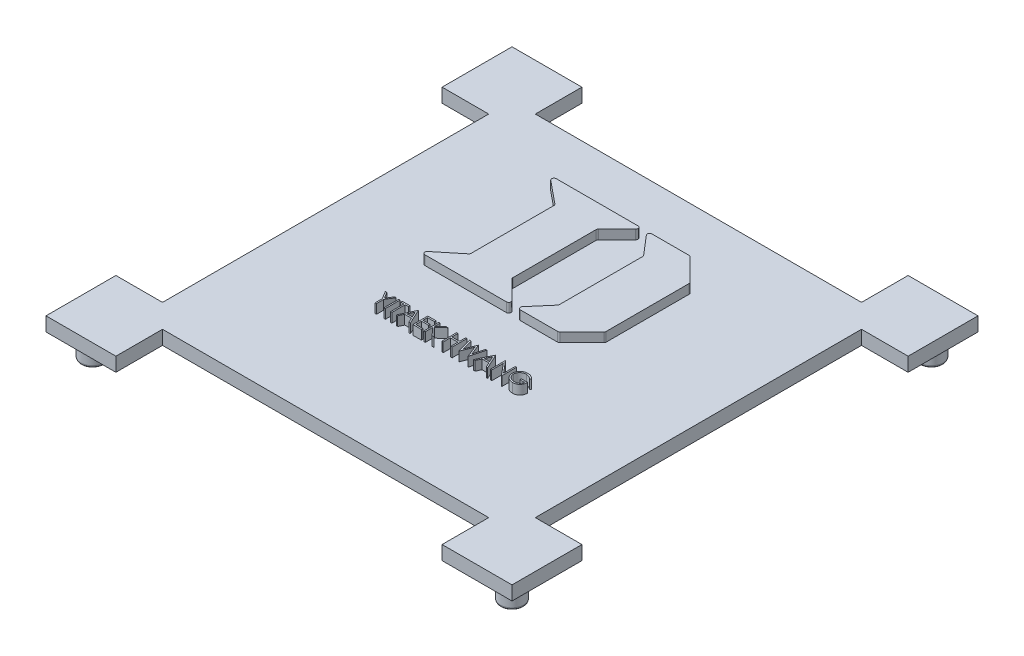
from build123d import *

# Parameters (mm, degrees)
BOSS_EXTRUDE1_DEPTH = 3
SKETCH2_W           = 0.284935898
SKETCH2_H           = 3.175
BOSS_EXTRUDE2_DEPTH = 2
BOSS_EXTRUDE6_DEPTH = 2
FILLET1_R           = 0.5
FILLET2_R           = 0.5
SKETCH5_R           = 2.5
BOSS_EXTRUDE7_DEPTH = 5
FILLET3_R           = 0.5


with BuildPart() as part:
    # Sketch1 → Boss-Extrude1 (new body)
    with BuildSketch(Plane(origin=(0, 0, 0), x_dir=(1, 0, 0), z_dir=(0, 1, 0))):
        Polygon((15, 10), (85, 10), (85, 0), (100, 0), (100, 15), (90, 15), (90, 85), (100, 85), (100, 100), (85, 100), (85, 90), (15, 90), (15, 100), (0, 100), (0, 85), (10, 85), (10, 15), (0, 15), (0, 0), (15, 0), align=None)
    extrude(amount=BOSS_EXTRUDE1_DEPTH)

    # Sketch2 → Boss-Extrude2 (add)
    # profile 1 of 11: a face of its own
    with BuildSketch(Plane(origin=(0, 3, 0), x_dir=(1, 0, 0), z_dir=(0, 1, 0))):
        Polygon((33.880769231, 38.928025518), (34.207046274, 38.928025518), (35.041501402, 37.563767705), (35.874684495, 38.928025518), (36.200961538, 38.928025518), (35.183333333, 37.26229535), (35.183333333, 35.753025518), (34.898397436, 35.753025518), (34.898397436, 37.26229535), align=None)
    # profile 2 of 11: a face of its own
    with BuildSketch(Plane(origin=(0, 3, 0), x_dir=(1, 0, 0), z_dir=(0, 1, 0))):
        with Locations((36.913301282, 37.340525518)):
            Rectangle(SKETCH2_W, SKETCH2_H)
    # profile 3 of 11: a face of its own
    with BuildSketch(Plane(origin=(0, 3, 0), x_dir=(1, 0, 0), z_dir=(0, 1, 0))):
        Polygon((37.503525641, 38.602384492), (37.503525641, 38.928025518), (39.172435897, 38.928025518), (39.172435897, 38.602384492), (38.480448718, 38.602384492), (38.480448718, 35.753025518), (38.195512821, 35.753025518), (38.195512821, 38.602384492), align=None)
    # profile 4 of 11: a face of its own
    with BuildSketch(Plane(origin=(0, 3, 0), x_dir=(1, 0, 0), z_dir=(0, 1, 0))):
        Polygon((40.963461538, 38.928025518), (42.428846154, 35.753025518), (42.119105569, 35.753025518), (41.649724559, 36.770653723), (40.210416667, 36.770653723), (39.727679287, 35.753025518), (39.416666667, 35.753025518), (40.92275641, 38.928025518), align=None)
        Polygon((40.939928886, 38.309180366), (40.36496895, 37.096294749), (41.499624399, 37.096294749), align=None, mode=Mode.SUBTRACT)
    # profile 5 of 11: a face of its own
    with BuildSketch(Plane(origin=(0, 3, 0), x_dir=(1, 0, 0), z_dir=(0, 1, 0))):
        Polygon((42.998717949, 38.928025518), (44.78974359, 38.928025518), (44.78974359, 38.602384492), (43.283653846, 38.602384492), (43.283653846, 37.625461415), (44.78974359, 37.625461415), (44.78974359, 37.29982039), (43.283653846, 37.29982039), (43.283653846, 36.078666544), (44.78974359, 36.078666544), (44.78974359, 35.753025518), (42.998717949, 35.753025518), align=None)
    # profile 6 of 11: a face of its own
    with BuildSketch(Plane(origin=(0, 3, 0), x_dir=(1, 0, 0), z_dir=(0, 1, 0))):
        Polygon((45.359615385, 38.928025518), (45.644551282, 38.928025518), (45.644551282, 37.718956007), (46.968103966, 38.928025518), (47.374519231, 38.928025518), (45.814367989, 37.503346031), (47.496634615, 35.753025518), (47.116932091, 35.753025518), (45.644551282, 37.285191984), (45.644551282, 35.753025518), (45.359615385, 35.753025518), align=None)
    # profile 7 of 11: a face of its own
    with BuildSketch(Plane(origin=(0, 3, 0), x_dir=(1, 0, 0), z_dir=(0, 1, 0))):
        Polygon((49.185897436, 38.928025518), (49.470833333, 38.928025518), (49.470833333, 37.625461415), (51.099038462, 37.625461415), (51.099038462, 38.928025518), (51.383974359, 38.928025518), (51.383974359, 35.753025518), (51.099038462, 35.753025518), (51.099038462, 37.29982039), (49.470833333, 37.29982039), (49.470833333, 35.753025518), (49.185897436, 35.753025518), align=None)
    # profile 8 of 11: a face of its own
    with BuildSketch(Plane(origin=(0, 3, 0), x_dir=(1, 0, 0), z_dir=(0, 1, 0))):
        Polygon((51.994551282, 38.928025518), (52.289027444, 38.928025518), (52.910416667, 36.599564981), (53.83455028, 38.928025518), (53.875891426, 38.928025518), (54.782852564, 36.615465422), (55.407421875, 38.928025518), (55.698717949, 38.928025518), (54.842638221, 35.753025518), (54.801933093, 35.753025518), (53.846634615, 38.181340822), (52.879887821, 35.753025518), (52.839182692, 35.753025518), align=None)
    # profile 9 of 11: a face of its own
    with BuildSketch(Plane(origin=(0, 3, 0), x_dir=(1, 0, 0), z_dir=(0, 1, 0))):
        Polygon((57.571153846, 38.928025518), (59.036538462, 35.753025518), (58.726797877, 35.753025518), (58.257416867, 36.770653723), (56.818108974, 36.770653723), (56.335371595, 35.753025518), (56.024358974, 35.753025518), (57.530448718, 38.928025518), align=None)
        Polygon((57.547621194, 38.309180366), (56.972661258, 37.096294749), (58.107316707, 37.096294749), align=None, mode=Mode.SUBTRACT)
    # profile 10 of 11: a face of its own
    with BuildSketch(Plane(origin=(0, 3, 0), x_dir=(1, 0, 0), z_dir=(0, 1, 0))):
        Polygon((59.606410256, 35.753025518), (59.606410256, 38.928025518), (59.666195913, 38.928025518), (61.763782051, 36.429112257), (61.763782051, 38.928025518), (62.048717949, 38.928025518), (62.048717949, 35.753025518), (61.983844151, 35.753025518), (59.891346154, 38.246214621), (59.891346154, 35.753025518), align=None)
    # profile 11 of 11: a face of its own
    with BuildSketch(Plane(origin=(0, 3, 0), x_dir=(1, 0, 0), z_dir=(0, 1, 0))):
        with BuildLine():
            Line((65.834294872, 38.386138499), (65.590064103, 38.154628082))
            add(Edge.make_bspline(
                [(65.590064103, 38.154628082), (65.545869111, 38.196203222), (65.458532983, 38.278362119), (65.31614762, 38.384961379), (65.167590609, 38.476279913), (65.01363713, 38.55058057), (64.858099728, 38.60986486), (64.703042909, 38.65207253), (64.550057166, 38.67898976), (64.448305475, 38.682208638), (64.398167067, 38.683794749)],
                knots=[0, 0, 0, 0, 1.08915593, 2.152340314, 3.188132944, 4.216796309, 5.218260357, 6.173443236, 7.099959455, 8, 8, 8, 8], degree=3))
            add(Edge.make_bspline(
                [(64.398167067, 38.683794749), (64.36740159, 38.683419549), (64.305950426, 38.682670123), (64.214671948, 38.673105013), (64.124350784, 38.659348315), (64.035157437, 38.639443898), (63.946918484, 38.614217108), (63.859940818, 38.582661723), (63.774062189, 38.545872323), (63.69009153, 38.503361365), (63.608684073, 38.45666179), (63.531797515, 38.404910614), (63.458941789, 38.349766497), (63.39148626, 38.289848823), (63.329042912, 38.225700338), (63.27012546, 38.158514339), (63.216806056, 38.086455248), (63.168644785, 38.010848859), (63.125681031, 37.933023087), (63.08775461, 37.853727018), (63.055916537, 37.773223664), (63.030725674, 37.691412008), (63.009942438, 37.608924973), (62.995321466, 37.525191405), (62.987078511, 37.440121647), (62.985652682, 37.383155563), (62.984935897, 37.354517906)],
                knots=[0, 0, 0, 0, 1.02818874, 2.053710826, 3.065248034, 4.081641283, 5.106893873, 6.131558223, 7.173050175, 8.228653731, 9.27666206, 10.308777013, 11.325269123, 12.329503258, 13.32196095, 14.316845687, 15.314881793, 16.315733098, 17.311955233, 18.285320748, 19.252783886, 20.203351036, 21.145449891, 22.095197417, 23.042428769, 24, 24, 24, 24], degree=3))
            add(Edge.make_bspline(
                [(62.984935897, 37.354517906), (62.985621442, 37.325243664), (62.986990659, 37.26677512), (62.995753949, 37.179513354), (63.012017424, 37.093547596), (63.03375956, 37.008595361), (63.060956443, 36.924511158), (63.09485879, 36.841659524), (63.135014013, 36.760043526), (63.181492885, 36.680398545), (63.232461798, 36.602816945), (63.289560165, 36.529737951), (63.350212265, 36.460188417), (63.416627732, 36.395712545), (63.486676888, 36.334585725), (63.562452595, 36.278492073), (63.642464827, 36.226351113), (63.726835655, 36.178819985), (63.814649608, 36.136357956), (63.904689662, 36.098599136), (63.997243467, 36.06750288), (64.091824621, 36.042159029), (64.188320374, 36.021385188), (64.287220538, 36.008020724), (64.387797924, 35.998322613), (64.45559654, 35.997613526), (64.489753606, 35.997256287)],
                knots=[0, 0, 0, 0, 0.93586088, 1.869166235, 2.799637598, 3.729985548, 4.670839027, 5.622275134, 6.589130586, 7.576015415, 8.568469353, 9.55398029, 10.53834874, 11.515998671, 12.510579167, 13.508179873, 14.527009472, 15.561807829, 16.601455013, 17.643573243, 18.680854198, 19.719860599, 20.772568776, 21.833555941, 22.908541556, 24, 24, 24, 24], degree=3))
            add(Edge.make_bspline(
                [(64.489753606, 35.997256287), (64.530918249, 35.998116781), (64.611751715, 35.999806502), (64.730575131, 36.012960336), (64.844696488, 36.033504213), (64.953795115, 36.063590419), (65.057997727, 36.101965896), (65.157686323, 36.148225996), (65.252076042, 36.204145057), (65.341450635, 36.267258493), (65.423780368, 36.33757552), (65.498033752, 36.41345299), (65.563026446, 36.494522593), (65.619727137, 36.580306844), (65.666634274, 36.671515799), (65.705135952, 36.767702481), (65.734648295, 36.868910152), (65.746763165, 36.938843275), (65.752884615, 36.974179364)],
                knots=[0, 0, 0, 0, 1.13008108, 2.219097802, 3.278683437, 4.311054135, 5.322181354, 6.324827112, 7.324222904, 8.330512327, 9.32562643, 10.293043162, 11.24128371, 12.174520618, 13.111833804, 14.052305215, 15.015860969, 16, 16, 16, 16], degree=3))
            Line((65.752884615, 36.974179364), (64.694551282, 36.974179364))
            Line((64.694551282, 36.974179364), (64.694551282, 37.29982039))
            Line((64.694551282, 37.29982039), (66.037820513, 37.29982039))
            add(Edge.make_bspline(
                [(66.037820513, 37.29982039), (66.036273065, 37.239125739), (66.033244429, 37.120335344), (66.012000127, 36.947098027), (65.977695148, 36.783475134), (65.930831865, 36.629294347), (65.870166432, 36.48477416), (65.796349924, 36.349767838), (65.708200929, 36.225147563), (65.608859314, 36.109895967), (65.497371495, 36.007090182), (65.376749961, 35.916733367), (65.246795426, 35.840621709), (65.107630815, 35.778699536), (64.959711707, 35.730372412), (64.80269582, 35.696108196), (64.636796082, 35.675579587), (64.523097811, 35.672956693), (64.464948918, 35.671615262)],
                knots=[0, 0, 0, 0, 1.140356446, 2.231883559, 3.274166699, 4.278491846, 5.25512956, 6.21435461, 7.1637429, 8.11826594, 9.068280886, 10.0076534, 10.945064095, 11.891975133, 12.864533718, 13.863980011, 14.907571808, 16, 16, 16, 16], degree=3))
            add(Edge.make_bspline(
                [(64.464948918, 35.671615262), (64.429107581, 35.672131536), (64.358416913, 35.673149795), (64.254013, 35.680386389), (64.15248773, 35.691526626), (64.053855893, 35.708349702), (63.957754683, 35.728955138), (63.864664059, 35.755340948), (63.774229407, 35.785883268), (63.686310949, 35.820622914), (63.601706682, 35.860874346), (63.52003977, 35.905605233), (63.440858784, 35.954584925), (63.364703085, 36.008660477), (63.291175871, 36.067427423), (63.220751247, 36.13100355), (63.153034958, 36.199194494), (63.110616537, 36.247616882), (63.089242788, 36.272015903)],
                knots=[0, 0, 0, 0, 1.107784379, 2.184907829, 3.233506516, 4.263428166, 5.276301166, 6.270063455, 7.25232949, 8.225834625, 9.190232166, 10.146266622, 11.1027726, 12.066435141, 13.031522626, 14.010570082, 14.99756817, 16, 16, 16, 16], degree=3))
            add(Edge.make_bspline(
                [(63.089242788, 36.272015903), (63.058231264, 36.310724281), (62.996722976, 36.387498518), (62.91754922, 36.510507039), (62.850056518, 36.637871583), (62.79529428, 36.76994671), (62.752533301, 36.906608882), (62.721866201, 37.047683468), (62.70389816, 37.193352133), (62.701309594, 37.291927051), (62.7, 37.341797553)],
                knots=[0, 0, 0, 0, 1.023165419, 2.029347347, 3.013907458, 3.994755782, 4.975994455, 5.96558838, 6.970761222, 8, 8, 8, 8], degree=3))
            add(Edge.make_bspline(
                [(62.7, 37.341797553), (62.700482816, 37.379141225), (62.701442312, 37.453353954), (62.713076887, 37.563533083), (62.729769602, 37.671755854), (62.754305144, 37.777933801), (62.785235327, 37.882137838), (62.823837418, 37.984416348), (62.868781717, 38.084829689), (62.921019988, 38.182686698), (62.979153748, 38.276688844), (63.042245734, 38.366457708), (63.111191857, 38.450358503), (63.184866189, 38.529453784), (63.264147744, 38.602749881), (63.348293793, 38.670925395), (63.437369183, 38.734071778), (63.531654146, 38.791194414), (63.629741403, 38.842505698), (63.731395832, 38.887490197), (63.836586404, 38.924667919), (63.944525045, 38.956212705), (64.056028778, 38.979540011), (64.170288443, 38.996457087), (64.287899616, 39.008032774), (64.367398014, 39.008963735), (64.407707332, 39.009435774)],
                knots=[0, 0, 0, 0, 1.008945113, 2.00506715, 2.99143336, 3.967273523, 4.948097931, 5.927297278, 6.919902385, 7.919676788, 8.923139349, 9.905703106, 10.883022732, 11.856032218, 12.825136022, 13.798837087, 14.781400844, 15.773989409, 16.776158564, 17.77167057, 18.775803737, 19.789618931, 20.80898985, 21.851988756, 22.910860228, 24, 24, 24, 24], degree=3))
            add(Edge.make_bspline(
                [(64.407707332, 39.009435774), (64.440580596, 39.008910093), (64.505764415, 39.007867727), (64.602761329, 39.000642654), (64.698258993, 38.98919099), (64.792399003, 38.973563834), (64.884860778, 38.952278914), (64.975907718, 38.926807899), (65.065671805, 38.897151746), (65.153871717, 38.861783292), (65.241100502, 38.821638933), (65.327843171, 38.776451042), (65.413803344, 38.725446931), (65.499130092, 38.668475152), (65.584361477, 38.606514195), (65.668149403, 38.537791933), (65.752516359, 38.465018433), (65.806765148, 38.412692452), (65.834294872, 38.386138499)],
                knots=[0, 0, 0, 0, 0.985871117, 1.954866573, 2.915460327, 3.869826059, 4.81536089, 5.759505086, 6.70452669, 7.649098992, 8.607881297, 9.583363685, 10.581137262, 11.603961102, 12.659522466, 13.73993555, 14.853081303, 16, 16, 16, 16], degree=3))
        make_face()
    extrude(amount=BOSS_EXTRUDE2_DEPTH)

    # Sketch4 → Boss-Extrude6 (add)
    with BuildSketch(Plane(origin=(0, 3, 0), x_dir=(1, 0, 0), z_dir=(0, 1, 0))):
        Polygon((36, 55), (29.874668424, 50), (50, 50), (45, 55), (45, 73.236476997), (50, 78.236476997), (29.874668424, 78.236476997), (36, 73.236476997), align=None)
        Polygon((55, 55), (50.715298615, 50), (60, 50), (65, 55), (65, 73.236476997), (60, 78.236476997), (50.715298615, 78.236476997), (55, 73.236476997), align=None)
    extrude(amount=BOSS_EXTRUDE6_DEPTH)

    # Fillet1
    fillet1_edges = [part.edges().sort_by_distance(p)[0] for p in [
        (36, 4, -55),
        (29.874668424, 4, -50),
        (50, 4, -50),
        (45, 4, -55),
        (45, 4, -73.236476997),
        (50, 4, -78.236476997),
        (29.874668424, 4, -78.236476997),
        (36, 4, -73.236476997),
    ]]
    fillet(fillet1_edges, radius=FILLET1_R)

    # Fillet2
    fillet2_edges = [part.edges().sort_by_distance(p)[0] for p in [
        (55, 4, -55),
        (50.715298615, 4, -50),
        (60, 4, -50),
        (65, 4, -55),
        (65, 4, -73.236476997),
        (60, 4, -78.236476997),
        (50.715298615, 4, -78.236476997),
        (55, 4, -73.236476997),
    ]]
    fillet(fillet2_edges, radius=FILLET2_R)

    # Sketch5 → Boss-Extrude7 (add)
    with BuildSketch(Plane(origin=(0, 0, 0), x_dir=(-1, 0, 0), z_dir=(0, -1, 0))):
        with Locations(Location((-5, 95, 0), (0, 0, 90))):
            Circle(SKETCH5_R)
        with Locations(Location((-95, 95, 0), (0, 0, 90))):
            Circle(SKETCH5_R)
        with Locations(Location((-5, 5, 0), (0, 0, 90))):
            Circle(SKETCH5_R)
        with Locations(Location((-95, 5, 0), (0, 0, 90))):
            Circle(SKETCH5_R)
    extrude(amount=BOSS_EXTRUDE7_DEPTH)

    # Fillet3
    fillet3_edges = [part.edges().sort_by_distance(p)[0] for p in [
        (5, -5, -92.5),
        (95, -5, -92.5),
        (5, -5, -2.5),
        (95, -5, -2.5),
    ]]
    fillet(fillet3_edges, radius=FILLET3_R)


solid = part.part
